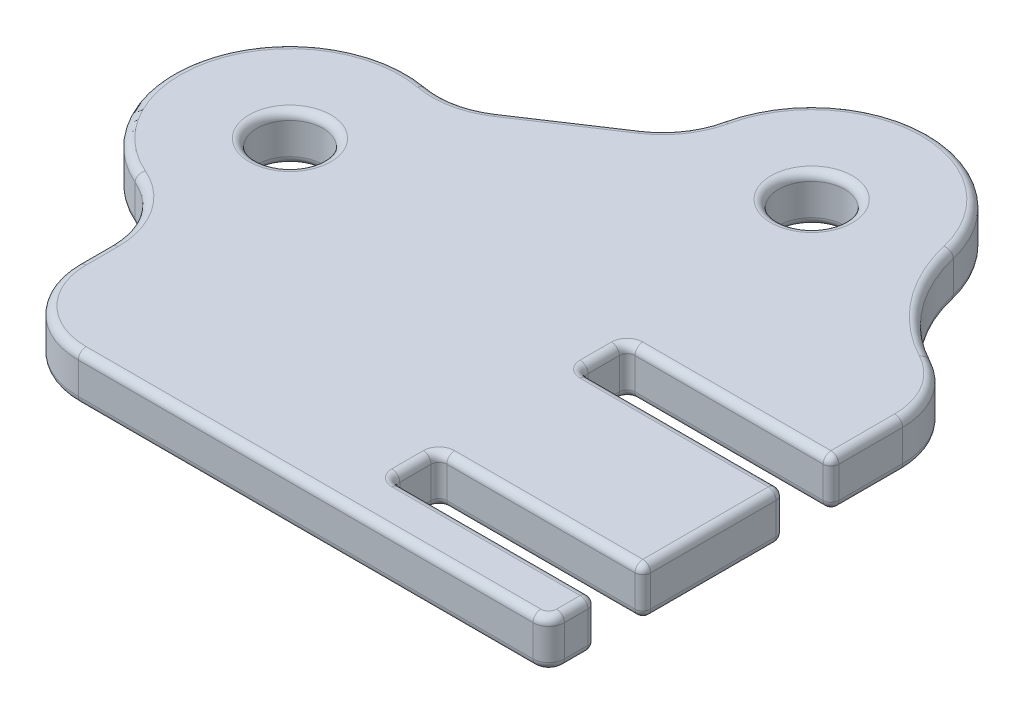
from build123d import *

# Parameters (mm, degrees)
SKETCH1_R           = 2.1
BOSS_EXTRUDE1_DEPTH = 3
FILLET1_R           = 5
SKETCH2_W           = 8
SKETCH2_H           = 3
CUT_EXTRUDE1_DEPTH  = 3
BOSS_EXTRUDE2_DEPTH = 3
FILLET2_R           = 10
SKETCH5_W           = 13
SKETCH5_H           = 3
CUT_EXTRUDE3_DEPTH  = 3.5
FILLET3_R           = 5
FILLET4_R           = 1
FILLET5_R           = 0.5


with BuildPart() as part:
    # Sketch1 → Boss-Extrude1 (new body)
    with BuildSketch(Plane(origin=(0, 0, 0), x_dir=(1, 0, 0), z_dir=(0, 1, 0))):
        with BuildLine():
            Line((0, -11.456439237), (0, -18.5))
            Line((0, -18.5), (30, -18.5))
            Line((30, -18.5), (30, -10.955880937))
            ThreePointArc((30, -10.955880937), (29.758770483, -9.587800364), (29.064177772, -8.384730498))
            Line((29.064177772, -8.384730498), (22.591994863, -0.671483264))
            ThreePointArc((22.591994863, -0.671483264), (21.491397009, 3.371317526), (23.853330247, 6.832072535))
            ThreePointArc((23.853330247, 6.832072535), (24.386195315, 19.350189707), (12.677699795, 14.889434685))
            ThreePointArc((12.677699795, 14.889434685), (11.918282987, 13.141523465), (10.560020318, 11.804725034))
            Line((10.560020318, 11.804725034), (5.017813295, 8.128440794))
            ThreePointArc((5.017813295, 8.128440794), (3.258028142, 7.396960283), (1.352375582, 7.377064476))
            ThreePointArc((1.352375582, 7.377064476), (-7.172928544, 2.190683933), (-3, -6.873863542))
            ThreePointArc((-3, -6.873863542), (-0.816699867, -8.71782645), (0, -11.456439237))
        make_face()
        with Locations(Location((0, 0, 0), (0, 0, 270))):
            Circle(SKETCH1_R, mode=Mode.SUBTRACT)
        with Locations(Location((20, 13.266499161, 0), (0, 0, 270))):
            Circle(SKETCH1_R, mode=Mode.SUBTRACT)
    extrude(amount=BOSS_EXTRUDE1_DEPTH)

    # Fillet1
    fillet1_edges = [part.edges().sort_by_distance(p)[0] for p in [
        (0, 1.5, 18.5),
    ]]
    fillet(fillet1_edges, radius=FILLET1_R)

    # Sketch2 → Cut-Extrude1 (cut)
    with BuildSketch(Plane(origin=(0, 3, 0), x_dir=(1, 0, 0), z_dir=(0, 1, 0))):
        with Locations((26, -14)):
            Rectangle(SKETCH2_W, SKETCH2_H)
    extrude(amount=-CUT_EXTRUDE1_DEPTH, mode=Mode.SUBTRACT)

    # Sketch4 → Boss-Extrude2 (add)
    with BuildSketch(Plane(origin=(0, 3, 0), x_dir=(1, 0, 0), z_dir=(0, 1, 0))):
        Polygon((27.12691506, 10.930459408), (35, 7.210028784), (35, -0.5), (22, -0.5), (22, -3.5), (35, -3.5), (35, -12.5), (22, -12.5), (22, -15.5), (35, -15.5), (35, -18.5), (18.101899038, -18.5), (15.526805317, 5.265582811), align=None)
    extrude(amount=-BOSS_EXTRUDE2_DEPTH)

    # Fillet2
    fillet2_edges = [part.edges().sort_by_distance(p)[0] for p in [
        (27.12691506, 1.5, -10.930459408),
    ]]
    fillet(fillet2_edges, radius=FILLET2_R)

    # Sketch5 → Cut-Extrude3 (cut)
    with BuildSketch(Plane(origin=(0, 3, 0), x_dir=(1, 0, 0), z_dir=(0, 1, 0))):
        with Locations((28.5, -2)):
            Rectangle(SKETCH5_W, SKETCH5_H)
    extrude(amount=-CUT_EXTRUDE3_DEPTH, mode=Mode.SUBTRACT)

    # Fillet3
    fillet3_edges = [part.edges().sort_by_distance(p)[0] for p in [
        (35, 1.5, -7.210028784),
    ]]
    fillet(fillet3_edges, radius=FILLET3_R)

    # Fillet4
    fillet4_edges = [part.edges().sort_by_distance(p)[0] for p in [
        (35, 1.5, 18.5),
    ]]
    fillet(fillet4_edges, radius=FILLET4_R)

    # Fillet5
    fillet5_edges = [part.edges().sort_by_distance(p)[0] for p in [
        (-0.816699867, 3, 8.71782645),
        (7.788916806, 0, -9.966582914),
        (11.918282987, 0, -13.141523465),
        (19.942894424, 3, -20.766281755),
        (19.942894424, 0, -20.766281755),
        (29.115642574, 0, -11.195020687),
        (0, 3, 12.478219619),
        (22, 0, 2),
        (22, 1.5, 0.5),
        (22, 3, 2),
        (22, 1.5, 3.5),
        (0, 0, 12.478219619),
        (-0.816699867, 0, 8.71782645),
        (-7.172928544, 0, -2.190683933),
        (3.258028142, 0, -7.396960283),
        (29.115642574, 3, -11.195020687),
        (34.28424644, 3, -6.638019863),
        (34.28424644, 0, -6.638019863),
        (35, 3, 16.5),
        (34.707106781, 3, 18.207106781),
        (35, 0, 16.5),
        (34.707106781, 0, 18.207106781),
        (0, 0, -2.1),
        (0, 3, -2.1),
        (20, 0, -15.366499161),
        (20, 3, -15.366499161),
        (11.918282987, 3, -13.141523465),
        (7.788916806, 3, -9.966582914),
        (3.258028142, 3, -7.396960283),
        (19.5, 0, 18.5),
        (19.5, 3, 18.5),
        (1.464466094, 0, 17.035533906),
        (1.464466094, 3, 17.035533906),
        (28.5, 0, 15.5),
        (22, 0, 14),
        (22, 1.5, 15.5),
        (28.5, 0, 12.5),
        (22, 1.5, 12.5),
        (28.5, 3, 12.5),
        (22, 3, 14),
        (28.5, 3, 15.5),
        (-7.172928544, 3, -2.190683933),
        (28.5, 0, 3.5),
        (28.5, 0, 0.5),
        (35, 1.5, 0.5),
        (35, 1.5, 12.5),
        (35, 3, 8),
        (28.5, 3, 3.5),
        (28.5, 3, 0.5),
        (35, 3, -1.780092514),
        (35, 0, -1.780092514),
        (35, 0, 8),
        (35, 1.5, 3.5),
        (35, 1.5, 15.5),
    ]]
    fillet(fillet5_edges, radius=FILLET5_R)


solid = part.part
